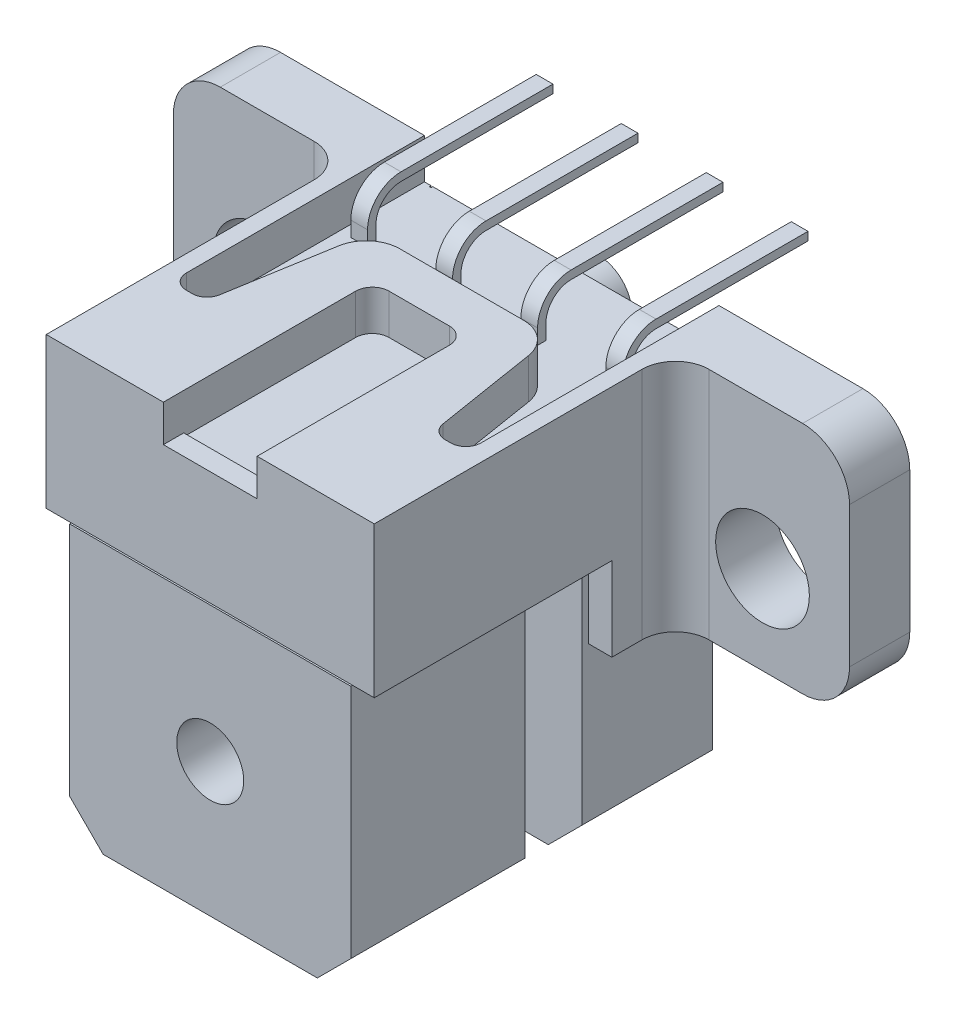
from build123d import *

# Parameters (mm, degrees)
EXTRUDE_1_DEPTH      = 10.8
SKETCH_2_R           = 1
EXTRUDE_2_DEPTH      = 0.8
SKETCH_3_W           = 1.7
SKETCH_3_H           = 8.1
CUT_EXTRUDE_1_DEPTH  = 17.8
EXTRUDE_START        = -4.5
EXTRUDE_3_DEPTH      = 4.5
SKETCH_5_W           = 8.4
SKETCH_5_H           = 0.05
CUT_EXTRUDE_2_DEPTH  = 1
SKETCH_6_R           = 1
CUT_EXTRUDE_3_DEPTH  = 8
CUT_EXTRUDE_4_DEPTH  = 1.2
SKETCH_8_W           = 2.8
SKETCH_8_H           = 0.608363533
EXTRUDE_4_DEPTH      = 0.1
EXTRUDE_START_2      = 2.5
EXTRUDE_5_DEPTH      = 2.5
SKETCH_10_W          = 8.4
SKETCH_10_H          = 1.7
CUT_EXTRUDE_5_DEPTH  = 0.05
FILLET_1_R           = 1.4
SKETCH_11_W          = 0.05
SKETCH_11_H          = 5.83834946
SKETCH_11_H_2        = 5.828769054
CUT_EXTRUDE_8_DEPTH  = 0.05
SKETCH_12_R          = 1.4
CUT_EXTRUDE_9_DEPTH  = 4
SKETCH_13_W          = 0.5
SKETCH_13_H          = 5.54
EXTRUDE_6_DEPTH      = 1.45
FILLET_2_R           = 1
CUT_EXTRUDE_START    = -8.12
CUT_EXTRUDE_10_DEPTH = 8.12


with BuildPart() as part:
    # Эскиз1 → Бобышка-Вытянуть1 (new body)
    with BuildSketch(Plane.XY):
        Polygon((7.4, 0), (8.4, 1), (8.4, 12.6), (0, 12.6), (0, 1), (1, 0), align=None)
    extrude(amount=EXTRUDE_1_DEPTH)

    # Эскиз2 → Бобышка-Вытянуть2 (add)
    with BuildSketch(Plane(origin=(0, 0, 0), x_dir=(-1, 0, 0), z_dir=(0, 0, -1))):
        with Locations((-4.2, 10.3)):
            Circle(SKETCH_2_R)
        with Locations((-4.2, 3.9)):
            Circle(SKETCH_2_R)
    extrude(amount=EXTRUDE_2_DEPTH)

    # Эскиз3 → Вырез-Вытянуть1 (cut)
    with BuildSketch(Plane(origin=(8.4, 0, 0), x_dir=(0, 0, -1), z_dir=(1, 0, 0))):
        with Locations((-4.75, 4.05)):
            Rectangle(SKETCH_3_W, SKETCH_3_H)
    extrude(amount=-CUT_EXTRUDE_1_DEPTH, mode=Mode.SUBTRACT)

    # Эскиз4 → Бобышка-Вытянуть3 (add)
    with BuildSketch(Plane(origin=(0, 12.6, 0), x_dir=(1, 0, 0), z_dir=(0, 1, 0)).offset(EXTRUDE_START)):
        with BuildLine():
            Line((9.1, -10.8), (-0.7, -10.8))
            Line((-0.7, -10.8), (-0.7, -2.8))
            ThreePointArc((-0.7, -2.8), (-0.992893219, -2.092893219), (-1.7, -1.8))
            Line((-1.7, -1.8), (-5.9, -1.8))
            Line((-5.9, -1.8), (-5.9, 0))
            Line((-5.9, 0), (14.3, 0))
            Line((14.3, 0), (14.3, -1.8))
            Line((14.3, -1.8), (10.1, -1.8))
            ThreePointArc((10.1, -1.8), (9.392893219, -2.092893219), (9.1, -2.8))
            Line((9.1, -2.8), (9.1, -10.8))
        make_face()
    extrude(amount=EXTRUDE_3_DEPTH)

    # Эскиз5 → Вырез-Вытянуть2 (cut)
    with BuildSketch(Plane.XY.offset(10.8)):
        with Locations((4.2, 8.075)):
            Rectangle(SKETCH_5_W, SKETCH_5_H)
    extrude(amount=-CUT_EXTRUDE_2_DEPTH, mode=Mode.SUBTRACT)

    # Эскиз6 → Вырез-Вытянуть3 (cut)
    with BuildSketch(Plane.XY.offset(10.8)):
        with Locations((4.2, 4)):
            Circle(SKETCH_6_R)
    extrude(amount=-CUT_EXTRUDE_3_DEPTH, mode=Mode.SUBTRACT)

    # Эскиз7 → Вырез-Вытянуть4 (cut)
    with BuildSketch(Plane(origin=(0, 12.6, 0), x_dir=(1, 0, 0), z_dir=(0, 1, 0))):
        with BuildLine():
            Line((8.6, 0), (8.6, -7.112411136))
            ThreePointArc((8.6, -7.112411136), (8.468198052, -7.430609188), (8.15, -7.562411136))
            Line((8.15, -7.562411136), (7.983405928, -7.562411136))
            ThreePointArc((7.983405928, -7.562411136), (7.691564003, -7.454943311), (7.539115931, -7.183870205))
            Line((7.539115931, -7.183870205), (7.049736844, -4.141202068))
            ThreePointArc((7.049736844, -4.141202068), (6.710963351, -3.53881739), (6.062425739, -3.3))
            Line((6.062425739, -3.3), (2.361664993, -3.3))
            ThreePointArc((2.361664993, -3.3), (1.71573807, -3.536600753), (1.37546474, -4.13444318))
            Line((1.37546474, -4.13444318), (0.863036378, -7.186911705))
            ThreePointArc((0.863036378, -7.186911705), (0.709913379, -7.455940797), (0.419246264, -7.562411136))
            Line((0.419246264, -7.562411136), (0.25, -7.562411136))
            ThreePointArc((0.25, -7.562411136), (-0.068198052, -7.430609188), (-0.2, -7.112411136))
            Line((-0.2, -7.112411136), (-0.2, 0))
            Line((-0.2, 0), (8.6, 0))
        make_face()
        with BuildLine():
            Line((4.2, -10.8), (5.6, -10.8))
            Line((5.6, -10.8), (5.6, -5.056380156))
            ThreePointArc((5.6, -5.056380156), (5.453553391, -4.702826765), (5.1, -4.556380156))
            Line((5.1, -4.556380156), (3.3, -4.556380156))
            ThreePointArc((3.3, -4.556380156), (2.946446609, -4.702826765), (2.8, -5.056380156))
            Line((2.8, -5.056380156), (2.8, -10.8))
            Line((2.8, -10.8), (4.2, -10.8))
        make_face()
    extrude(amount=-CUT_EXTRUDE_4_DEPTH, mode=Mode.SUBTRACT)

    # Эскиз8 → Бобышка-Вытянуть4 (add)
    with BuildSketch(Plane(origin=(0, 11.4, 0), x_dir=(1, 0, 0), z_dir=(0, 1, 0))):
        with Locations((4.2, -10.495818233)):
            Rectangle(SKETCH_8_W, SKETCH_8_H)
    extrude(amount=EXTRUDE_4_DEPTH)

    # Эскиз9 → Бобышка-Вытянуть5 (add)
    with BuildSketch(Plane.XZ.offset(-8.1).offset(EXTRUDE_START_2)):
        with BuildLine():
            Line((0, 0), (0, 3.7))
            Line((0, 3.7), (-0.7, 3.7))
            Line((-0.7, 3.7), (-0.7, 2.8))
            ThreePointArc((-0.7, 2.8), (-0.992893219, 2.092893219), (-1.7, 1.8))
            Line((-1.7, 1.8), (-5.9, 1.8))
            Line((-5.9, 1.8), (-5.9, 0))
            Line((-5.9, 0), (0, 0))
        make_face()
        with BuildLine():
            Line((14.3, 0), (8.4, 0))
            Line((8.4, 0), (8.4, 3.7))
            Line((8.4, 3.7), (9.1, 3.7))
            Line((9.1, 3.7), (9.1, 2.8))
            ThreePointArc((9.1, 2.8), (9.392893219, 2.092893219), (10.1, 1.8))
            Line((10.1, 1.8), (14.3, 1.8))
            Line((14.3, 1.8), (14.3, 0))
        make_face()
    extrude(amount=-EXTRUDE_5_DEPTH)

    # Эскиз10 → Вырез-Вытянуть5 (cut)
    with BuildSketch(Plane.XZ.offset(-8.1)):
        with Locations((4.2, 4.75)):
            Rectangle(SKETCH_10_W, SKETCH_10_H)
    extrude(amount=-CUT_EXTRUDE_5_DEPTH, mode=Mode.SUBTRACT)

    # Скругление1
    fillet_1_edges = [part.edges().sort_by_distance(p)[0] for p in [
        (-5.9, 5.6, 0.9),
        (14.3, 5.6, 0.9),
        (14.3, 12.6, 0.9),
        (-5.9, 12.6, 0.9),
    ]]
    fillet(fillet_1_edges, radius=FILLET_1_R)

    # Эскиз11 → Вырез-Вытянуть8 (cut)
    with BuildSketch(Plane(origin=(0, 0, 0), x_dir=(-1, 0, 0), z_dir=(0, 0, -1))):
        with Locations((-8.375, 8.48082527)):
            Rectangle(SKETCH_11_W, SKETCH_11_H)
        with Locations((-0.025, 8.485615473)):
            Rectangle(SKETCH_11_W, SKETCH_11_H_2)
    extrude(amount=-CUT_EXTRUDE_8_DEPTH, mode=Mode.SUBTRACT)

    # Эскиз12 → Вырез-Вытянуть9 (cut)
    with BuildSketch(Plane(origin=(0, 0, 0), x_dir=(-1, 0, 0), z_dir=(0, 0, -1))):
        with Locations((-11.7, 8.24)):
            Circle(SKETCH_12_R)
        with Locations((3.3, 8.24)):
            Circle(SKETCH_12_R)
    extrude(amount=-CUT_EXTRUDE_9_DEPTH, mode=Mode.SUBTRACT)

    # Эскиз13 → Бобышка-Вытянуть6 (add)
    with BuildSketch(Plane(origin=(0, 11.4, 0), x_dir=(1, 0, 0), z_dir=(0, 1, 0))):
        with Locations((5.47, 0.23)):
            Rectangle(SKETCH_13_W, SKETCH_13_H)
        with Locations((8.01, 0.23)):
            Rectangle(SKETCH_13_W, SKETCH_13_H)
        with Locations((2.93, 0.23)):
            Rectangle(SKETCH_13_W, SKETCH_13_H)
        with Locations((0.39, 0.23)):
            Rectangle(SKETCH_13_W, SKETCH_13_H)
    extrude(amount=EXTRUDE_6_DEPTH)

    # Скругление2
    fillet_2_edges = [part.edges().sort_by_distance(p)[0] for p in [
        (5.47, 12.85, 2.54),
        (2.93, 12.85, 2.54),
        (0.39, 12.85, 2.54),
        (8.01, 12.85, 2.54),
    ]]
    fillet(fillet_2_edges, radius=FILLET_2_R)

    # Эскиз14 → Вырез-Вытянуть10 (cut)
    with BuildSketch(Plane.ZY.offset(-0.14).offset(CUT_EXTRUDE_START)):
        with BuildLine():
            Line((-3, 12.6), (1.54, 12.6))
            ThreePointArc((1.54, 12.6), (2.070330086, 12.380330086), (2.29, 11.85))
            Line((2.29, 11.85), (2.29, 11.4))
            Line((2.29, 11.4), (-3, 11.4))
            Line((-3, 11.4), (-3, 12.6))
        make_face()
    extrude(amount=CUT_EXTRUDE_10_DEPTH, mode=Mode.SUBTRACT)


solid = part.part
